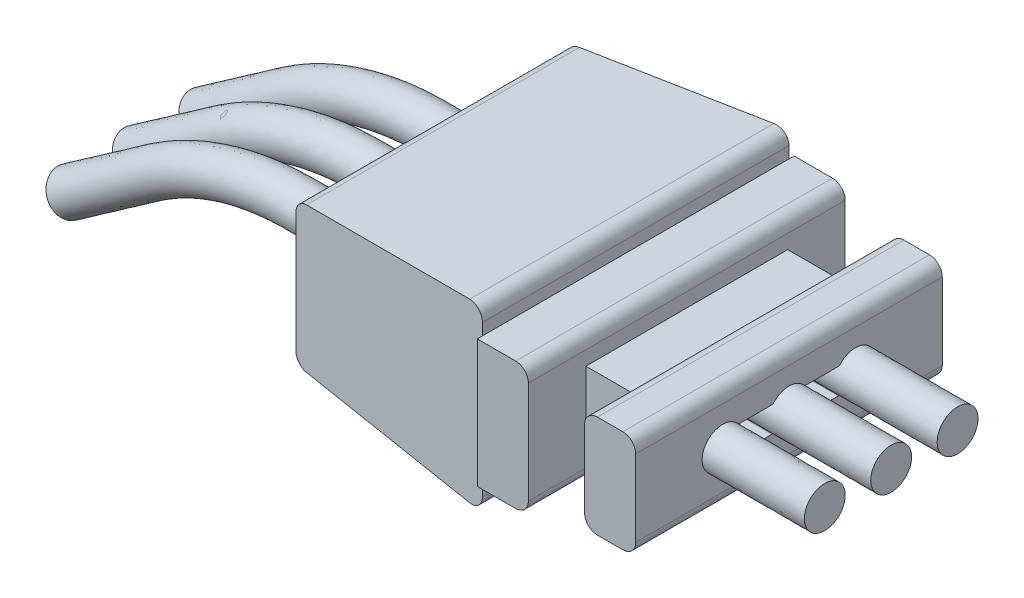
from build123d import *

# Parameters (mm, degrees)
SKETCH1_W            = 6
SKETCH1_H            = 2
BOSS_EXTRUDE1_DEPTH  = 1
SKETCH2_W            = 3.95
SKETCH2_H            = 1.45
BOSS_EXTRUDE2_DEPTH  = 1
SKETCH3_W            = 6.2
SKETCH3_H            = 2.5
BOSS_EXTRUDE3_DEPTH  = 1
SKETCH4_W            = 6
SKETCH4_H            = 3.5
BOSS_EXTRUDE4_DEPTH  = 4
BOSS_EXTRUDE4_TAPER  = 5
FILLET2_R            = 0.25
CUT_EXTRUDE6_DEPTH   = 8.848128852
SWEEP3_PROFILE_R     = 0.4
LPATTERN1_COUNT      = 2
LPATTERN1_PITCH      = 1.3
LPATTERN1_COUNT_DIR2 = 2
LPATTERN1_PITCH_DIR2 = 1.3


with BuildPart() as part:
    # Sketch1 → Boss-Extrude1 (new body)
    with BuildSketch(Plane(origin=(0, 0, 0), x_dir=(0, 0, -1), z_dir=(1, 0, 0))):
        Rectangle(SKETCH1_W, SKETCH1_H)
    extrude(amount=BOSS_EXTRUDE1_DEPTH)

    # Sketch2 → Boss-Extrude2 (add)
    with BuildSketch(Plane.ZY):
        Rectangle(SKETCH2_W, SKETCH2_H)
    extrude(amount=BOSS_EXTRUDE2_DEPTH)

    # Sketch3 → Boss-Extrude3 (add)
    with BuildSketch(Plane.ZY.offset(1)):
        Rectangle(SKETCH3_W, SKETCH3_H)
    extrude(amount=BOSS_EXTRUDE3_DEPTH)

    # Sketch4 → Boss-Extrude4 (add)
    with BuildSketch(Plane.ZY.offset(2)):
        Rectangle(SKETCH4_W, SKETCH4_H)
    extrude(amount=BOSS_EXTRUDE4_DEPTH, taper=BOSS_EXTRUDE4_TAPER)

    # Fillet2
    fillet2_edges = [part.edges().sort_by_distance(p)[0] for p in [
        (1, -1, 0),
        (-1, -1.25, 0),
        (-1, 1.25, 0),
        (-2, -1.75, 0),
        (-2, 1.75, 0),
        (-6, -1.400045346, 0),
        (-6, 1.400045346, 0),
        (0, -1, 0),
        (0, 1, 0),
        (1, 1, 0),
    ]]
    fillet(fillet2_edges, radius=FILLET2_R)

    # Sketch15 → Cut-Extrude6 (cut, through all)
    with BuildSketch(Plane.ZY.offset(6)):
        with BuildLine():
            Line((-0.964589803, 0.25), (-0.335410197, 0.25))
            ThreePointArc((-0.335410197, 0.25), (-0.314997782, 0.254356454), (-0.298142397, 0.266666667))
            ThreePointArc((-0.298142397, 0.266666667), (0, 0.4), (0.298142397, 0.266666667))
            ThreePointArc((0.298142397, 0.266666667), (0.314997782, 0.254356454), (0.335410197, 0.25))
            Line((0.335410197, 0.25), (0.964589803, 0.25))
            ThreePointArc((0.964589803, 0.25), (0.985002218, 0.254356454), (1.001857603, 0.266666667))
            ThreePointArc((1.001857603, 0.266666667), (1.7, 0), (1.001857603, -0.266666667))
            ThreePointArc((1.001857603, -0.266666667), (0.985002218, -0.254356454), (0.964589803, -0.25))
            Line((0.964589803, -0.25), (0.335410197, -0.25))
            ThreePointArc((0.335410197, -0.25), (0.314997782, -0.254356454), (0.298142397, -0.266666667))
            ThreePointArc((0.298142397, -0.266666667), (0, -0.4), (-0.298142397, -0.266666667))
            ThreePointArc((-0.298142397, -0.266666667), (-0.314997782, -0.254356454), (-0.335410197, -0.25))
            Line((-0.335410197, -0.25), (-0.964589803, -0.25))
            ThreePointArc((-0.964589803, -0.25), (-0.985002218, -0.254356454), (-1.001857603, -0.266666667))
            ThreePointArc((-1.001857603, -0.266666667), (-1.7, 0), (-1.001857603, 0.266666667))
            ThreePointArc((-1.001857603, 0.266666667), (-0.985002218, 0.254356454), (-0.964589803, 0.25))
        make_face()
    extrude(amount=-CUT_EXTRUDE6_DEPTH, mode=Mode.SUBTRACT)


with BuildPart() as body_2:
    # Sweep3: sweep along a path in Sketch10
    with BuildLine(Plane.XY) as sweep3_path:
        Line((-11.779692326, -2.051392651), (-10.141388237, -0.904239779))
        ThreePointArc((-10.141388237, -0.904239779), (-8.777035053, -0.231415246), (-7.273506056, 0))
        Line((-7.273506056, 0), (1, 0))
        Line((1, 0), (3, 0))
    # Sweep3 profile (on start of the path) → Sweep3 (sweep)
    with BuildSketch(Plane(origin=(-11.779692326, -2.051392651, 0), x_dir=(-0.5735764363510475, 0.8191520442889908, 0), z_dir=(0.8191520442889908, 0.5735764363510475, 0))):
        Circle(SWEEP3_PROFILE_R)
    sweep3 = sweep(path=sweep3_path.line)


with BuildPart() as lpattern1_1:
    # LPattern1: Sweep3 2 × 2
    with Locations(*[Vector(0, 0, 1) * (i * LPATTERN1_PITCH) + Vector(0, 0, -1) * (j * LPATTERN1_PITCH_DIR2) for i in range(LPATTERN1_COUNT) for j in range(LPATTERN1_COUNT_DIR2) if (i, j) != (0, 0)]):
        add(sweep3)


solid = Compound([part.part, body_2.part, lpattern1_1.part])
